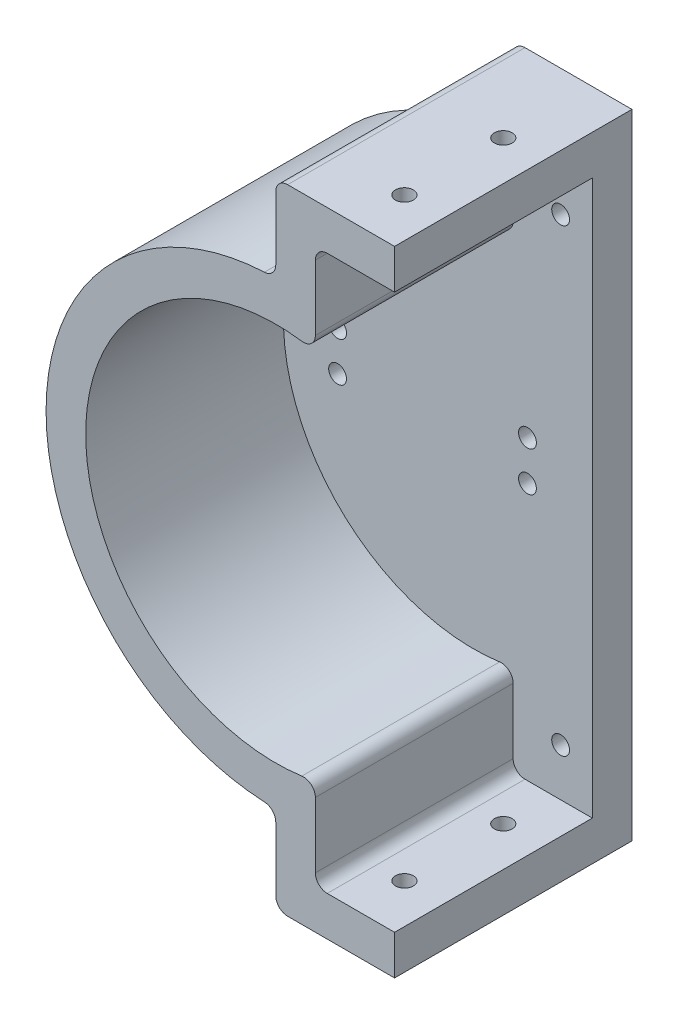
from build123d import *

# Parameters (mm, degrees)
BOSS_EXTRUDE2_DEPTH     = 10
SKETCH3_R               = 2.25
CUT_EXTRUDE2_DEPTH      = 100.317672143
SKETCH4_R               = 3.6
CUT_EXTRUDE3_DEPTH      = 5
BOSS_EXTRUDE4_DEPTH     = 49.94
CUT_EXTRUDE5_DEPTH      = 172.629844724
CUT_EXTRUDE5_DEPTH_BACK = 172.629844724
SKETCH7_R               = 2.25
CUT_EXTRUDE6_DEPTH      = 111.715868781
CUT_EXTRUDE6_DEPTH_BACK = 111.715868781
SKETCH8_R               = 2.25
FILLET1_R               = 3
CUT_EXTRUDE7_DEPTH      = 116.571638389
CUT_EXTRUDE7_DEPTH_BACK = 5
SKETCH9_R               = 3.6


with BuildPart() as part:
    # Sketch1 → Boss-Extrude2 (new body)
    with BuildSketch(Plane(origin=(0, 0, 0), x_dir=(0, 1, 0), z_dir=(0, 0, 1))):
        with BuildLine():
            Line((-58, 0), (-80, 0))
            Line((-80, 0), (-80, -30))
            Line((-80, -30), (80, -30))
            Line((80, -30), (80, 0))
            Line((80, 0), (58, 0))
            ThreePointArc((58, 0), (0, 58), (-58, 0))
        make_face()
    extrude(amount=BOSS_EXTRUDE2_DEPTH)

    # Sketch3 → Cut-Extrude2 (cut, through all)
    with BuildSketch(Plane.XY.offset(10)):
        with Locations((13.625, -5)):
            Circle(SKETCH3_R)
        with Locations((-34.325, -5)):
            Circle(SKETCH3_R)
        with Locations(Location((-34.325, 5, 0), (0, 0, 180))):
            Circle(SKETCH3_R)
        with Locations(Location((13.625, 5, 0), (0, 0, 180))):
            Circle(SKETCH3_R)
    extrude(amount=-CUT_EXTRUDE2_DEPTH, mode=Mode.SUBTRACT)

    # Sketch4 → Cut-Extrude3 (cut)
    with BuildSketch(Plane(origin=(0, 0, 0), x_dir=(1, 0, 0), z_dir=(0, 0, -1))):
        with Locations(Location((-34.325, -5, 0), (0, 0, 180))):
            Circle(SKETCH4_R)
        with Locations(Location((-34.325, 5, 0), (0, 0, 180))):
            Circle(SKETCH4_R)
        with Locations(Location((13.625, 5, 0), (0, 0, 180))):
            Circle(SKETCH4_R)
        with Locations(Location((13.625, -5, 0), (0, 0, 180))):
            Circle(SKETCH4_R)
    extrude(amount=-CUT_EXTRUDE3_DEPTH, mode=Mode.SUBTRACT)

    # Sketch5 → Boss-Extrude4 (add)
    with BuildSketch(Plane.XY.offset(10)):
        with BuildLine():
            Line((10, -46.946778377), (10, -70))
            Line((10, -70), (20, -70))
            Line((20, -70), (30, -70))
            Line((30, -70), (30, -80))
            Line((30, -80), (0, -80))
            Line((0, -80), (0, -58))
            ThreePointArc((0, -58), (-58, 0), (0, 58))
            Line((0, 58), (0, 80))
            Line((0, 80), (30, 80))
            Line((30, 80), (30, 70))
            Line((30, 70), (20, 70))
            Line((20, 70), (10, 70))
            Line((10, 70), (10, 46.946778377))
            ThreePointArc((10, 46.946778377), (-48, 0), (10, -46.946778377))
        make_face()
    extrude(amount=BOSS_EXTRUDE4_DEPTH)

    # Sketch7 → Cut-Extrude5 (cut, two sides: drawn at the far end of the back side and taken through both)
    with BuildSketch(Plane(origin=(0, -70, 0), x_dir=(-1, 0, 0), z_dir=(0, 1, 0)).offset(-CUT_EXTRUDE5_DEPTH_BACK)):
        with Locations(Location((-20, 47.455, 0), (0, 0, 90))):
            Circle(SKETCH7_R)
        with Locations((-20, 22.485)):
            Circle(SKETCH7_R)
    extrude(amount=CUT_EXTRUDE5_DEPTH + CUT_EXTRUDE5_DEPTH_BACK, mode=Mode.SUBTRACT)

    # Sketch8 → Cut-Extrude6 (cut, two sides: drawn at the far end of the back side and taken through both)
    with BuildSketch(Plane.XY.offset(10).offset(-CUT_EXTRUDE6_DEPTH_BACK)):
        with Locations((22, -58)):
            Circle(SKETCH8_R)
        with Locations((22, 58)):
            Circle(SKETCH8_R)
    extrude(amount=CUT_EXTRUDE6_DEPTH + CUT_EXTRUDE6_DEPTH_BACK, mode=Mode.SUBTRACT)

    # Fillet1
    fillet1_edges = [part.edges().sort_by_distance(p)[0] for p in [
        (0, 80, 29.97),
        (0, -80, 29.97),
        (0, -58, 29.97),
        (0, 58, 29.97),
        (10, -70, 34.97),
        (10, -46.946778377, 34.97),
        (10, 46.946778377, 34.97),
        (10, 70, 34.97),
    ]]
    fillet(fillet1_edges, radius=FILLET1_R)

    # Sketch9 → Cut-Extrude7 (cut, two sides: drawn at the far end of the back side and taken through both)
    with BuildSketch(Plane(origin=(0, 0, 0), x_dir=(1, 0, 0), z_dir=(0, 0, -1)).offset(-CUT_EXTRUDE7_DEPTH_BACK)):
        with Locations((22, 58)):
            Circle(SKETCH9_R)
        with Locations((22, -58)):
            Circle(SKETCH9_R)
    extrude(amount=CUT_EXTRUDE7_DEPTH + CUT_EXTRUDE7_DEPTH_BACK, mode=Mode.SUBTRACT)


solid = part.part
